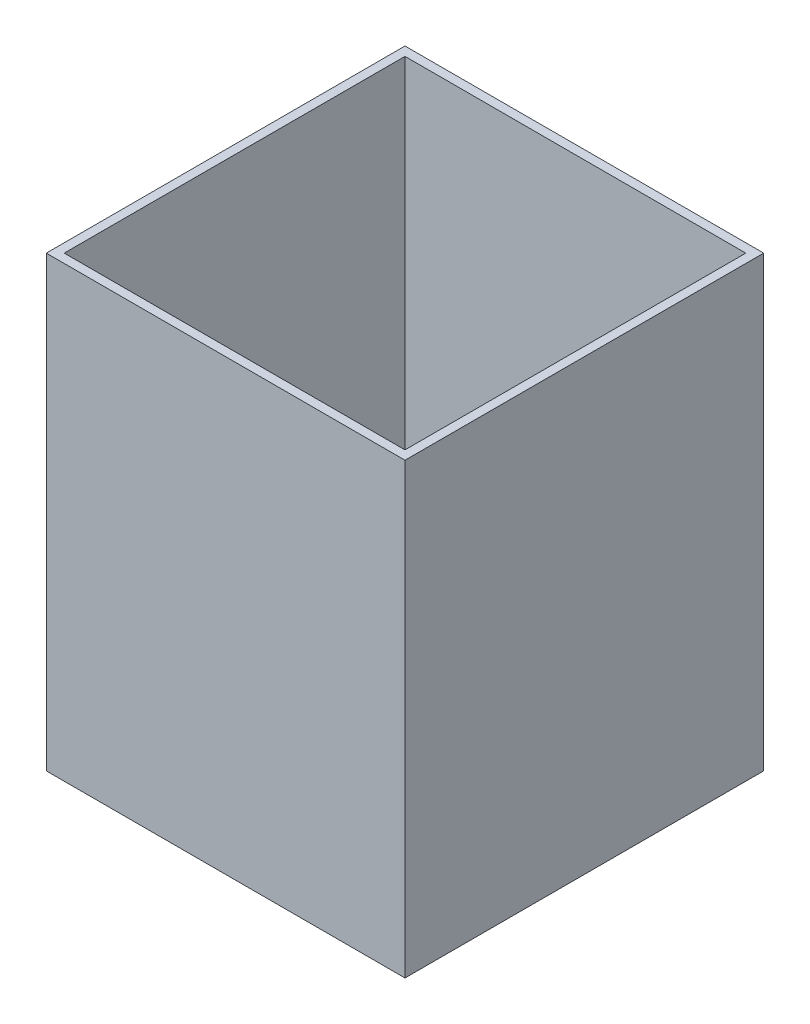
from build123d import *

# Parameters (mm, degrees)
SKETCH_1_W      = 80
SKETCH_1_H      = 80
SKETCH_1_W_2    = 76
SKETCH_1_H_2    = 76
EXTRUDE_1_DEPTH = 50


with BuildPart() as part:
    # 草图1 → 凸台-拉伸1 (new, symmetric)
    with BuildSketch(Plane(origin=(0, 0, 0), x_dir=(1, 0, 0), z_dir=(0, 1, 0))):
        with Locations((-10, 10)):
            Rectangle(SKETCH_1_W, SKETCH_1_H)
        with Locations((-10, 10)):
            Rectangle(SKETCH_1_W_2, SKETCH_1_H_2, mode=Mode.SUBTRACT)
    extrude(amount=EXTRUDE_1_DEPTH, both=True)


solid = part.part
